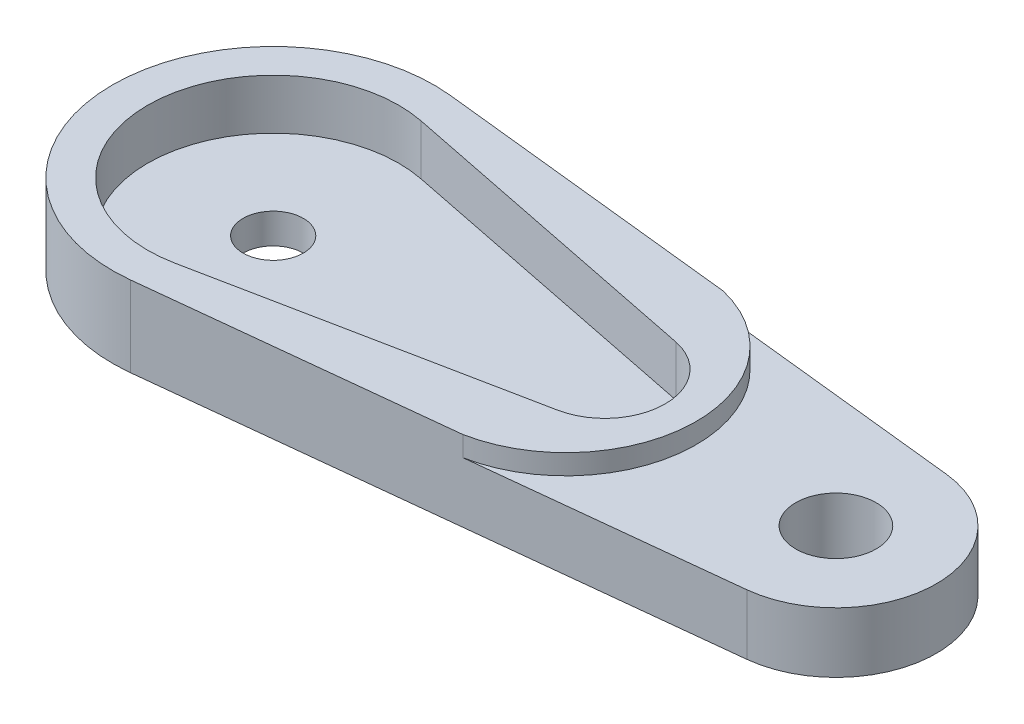
from build123d import *

# Parameters (mm, degrees)
SKETCH1_R           = 1.5
SKETCH1_R_2         = 2
BOSS_EXTRUDE1_DEPTH = 4
CUT_EXTRUDE1_DEPTH  = 2.5
CUT_EXTRUDE2_START  = -1
SKETCH3_R           = 2
CUT_EXTRUDE2_DEPTH  = 1


with BuildPart() as part:
    # Sketch1 → Boss-Extrude1 (new body)
    with BuildSketch(Plane(origin=(0, 0, 0), x_dir=(1, 0, 0), z_dir=(0, 1, 0))):
        with BuildLine():
            Line((28.535714286, 4.971218181), (0.857142857, 7.95394909))
            ThreePointArc((0.857142857, 7.95394909), (-8, 0), (0.857142857, -7.95394909))
            Line((0.857142857, -7.95394909), (28.535714286, -4.971218181))
            ThreePointArc((28.535714286, -4.971218181), (33, 0), (28.535714286, 4.971218181))
        make_face()
        with Locations(Location((0, 0, 0), (0, 0, 270))):
            Circle(SKETCH1_R, mode=Mode.SUBTRACT)
        with Locations(Location((28, 0, 0), (0, 0, 270))):
            Circle(SKETCH1_R_2, mode=Mode.SUBTRACT)
    extrude(amount=BOSS_EXTRUDE1_DEPTH)

    # Sketch2 → Cut-Extrude1 (cut)
    with BuildSketch(Plane(origin=(0, 4, 0), x_dir=(1, 0, 0), z_dir=(0, 1, 0))):
        with BuildLine():
            Line((17.090909091, 2.941228731), (1.231060606, 6.127559856))
            ThreePointArc((1.231060606, 6.127559856), (-6.25, 0), (1.231060606, -6.127559856))
            Line((1.231060606, -6.127559856), (17.090909091, -2.941228731))
            ThreePointArc((17.090909091, -2.941228731), (19.5, 0), (17.090909091, 2.941228731))
        make_face()
    extrude(amount=-CUT_EXTRUDE1_DEPTH, mode=Mode.SUBTRACT)

    # Sketch3 → Cut-Extrude2 (cut)
    with BuildSketch(Plane(origin=(0, 4, 0), x_dir=(1, 0, 0), z_dir=(0, 1, 0)).offset(CUT_EXTRUDE2_START)):
        with BuildLine():
            Line((28.535714286, 4.971218181), (16.073296283, 6.314207991))
            ThreePointArc((16.073296283, 6.314207991), (21.027764344, -0.131247863), (15.785851253, -6.345183982))
            Line((15.785851253, -6.345183982), (28.535714286, -4.971218181))
            ThreePointArc((28.535714286, -4.971218181), (33, 0), (28.535714286, 4.971218181))
        make_face()
        with Locations(Location((28, 0, 0), (0, 0, 270))):
            Circle(SKETCH3_R, mode=Mode.SUBTRACT)
    extrude(amount=CUT_EXTRUDE2_DEPTH, mode=Mode.SUBTRACT)


solid = part.part
